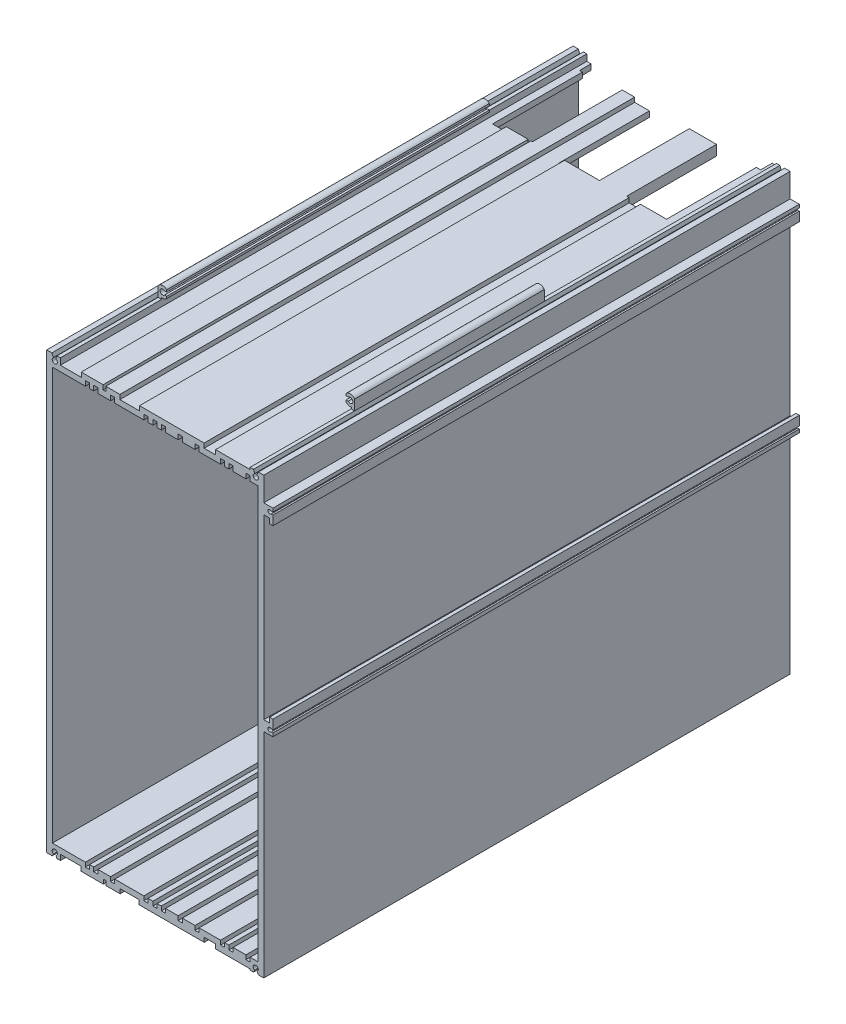
from build123d import *

# Parameters (mm, degrees)
BOSS_EXTRUDE1_DEPTH = 308
BOSS_EXTRUDE2_DEPTH = 188.8
CUT_EXTRUDE3_REACH  = 428.294
SKETCH4_W           = 77.8
SKETCH4_H           = 20.823727225
CUT_EXTRUDE4_REACH  = 424.481
SKETCH5_W           = 106
SKETCH5_H           = 6.75
CUT_EXTRUDE5_REACH  = 424.481
SKETCH6_W           = 23.35
SKETCH6_H           = 52.55


with BuildPart() as part:
    # Sketch2 → Boss-Extrude1 (new body)
    with BuildSketch(Plane.XY):
        with BuildLine():
            Line((14.499999531, 257.585773296), (14.499999531, 261.373383253))
            Line((14.499999531, 261.373383253), (12.499999531, 261.373383253))
            Line((12.499999531, 261.373383253), (11.766447114, 259.574707108))
            ThreePointArc((11.766447114, 259.574707108), (12.4449235, 259.022531512), (12.699999531, 258.185773296))
            ThreePointArc((12.699999531, 258.185773296), (10.428246686, 256.899539434), (10.494136136, 259.509312818))
            Line((10.494136136, 259.509312818), (9.499999531, 261.373383253))
            Line((9.499999531, 261.373383253), (6.499999531, 261.373383253))
            Line((6.499999531, 261.373383253), (6.499999531, 6.573383253))
            Line((6.499999531, 6.573383253), (9.699999531, 6.573383253))
            Line((9.699999531, 6.573383253), (10.453087922, 7.884956995))
            ThreePointArc((10.453087922, 7.884956995), (10.448456922, 10.483919553), (12.699999531, 9.185773296))
            ThreePointArc((12.699999531, 9.185773296), (12.47478685, 8.395256191), (11.866776475, 7.842118389))
            Line((11.866776475, 7.842118389), (12.496375142, 6.573383253))
            Line((12.496375142, 6.573383253), (14.496375142, 6.573383253))
            Line((14.496375142, 6.573383253), (14.496375142, 9.785773296))
            Line((14.496375142, 9.785773296), (26.596375142, 9.785773296))
            Line((26.596375142, 9.785773296), (26.596375142, 7.202035453))
            Line((26.596375142, 7.202035453), (39.696375142, 7.202035453))
            Line((39.696375142, 7.202035453), (39.696375142, 9.785773296))
            Line((39.696375142, 9.785773296), (41.199999531, 9.785773296))
            Line((41.199999531, 9.785773296), (41.199999531, 7.202035453))
            Line((41.199999531, 7.202035453), (49.449999531, 7.202035453))
            Line((49.449999531, 7.202035453), (49.449999531, 9.785773296))
            Line((49.449999531, 9.785773296), (60.549999531, 9.785773296))
            Line((60.549999531, 9.785773296), (60.549999531, 7.202035453))
            Line((60.549999531, 7.202035453), (98.649999531, 7.202035453))
            Line((98.649999531, 7.202035453), (98.649999531, 9.785773296))
            Line((98.649999531, 9.785773296), (105.249999531, 9.785773296))
            Line((105.249999531, 9.785773296), (105.249999531, 7.202035453))
            Line((105.249999531, 7.202035453), (125.499999531, 7.202035453))
            Line((125.499999531, 7.202035453), (125.499999531, 6.573383253))
            Line((125.499999531, 6.573383253), (127.499999531, 6.573383253))
            Line((127.499999531, 6.573383253), (128.131728013, 7.842861095))
            ThreePointArc((128.131728013, 7.842861095), (128.010191731, 10.461000193), (130.299999531, 9.185773296))
            ThreePointArc((130.299999531, 9.185773296), (130.098145789, 8.434230687), (129.54691114, 7.884956995))
            Line((129.54691114, 7.884956995), (130.299999531, 6.573383253))
            Line((130.299999531, 6.573383253), (133.499999531, 6.573383253))
            Line((133.499999531, 6.573383253), (133.499999531, 131.473383253))
            Line((133.499999531, 131.473383253), (138.849999531, 131.473383253))
            Line((138.849999531, 131.473383253), (138.849999531, 133.473383253))
            Line((138.849999531, 133.473383253), (137.935232058, 133.473383253))
            ThreePointArc((137.935232058, 133.473383253), (135.950499999, 134.164830282), (137.890474853, 134.973383253))
            Line((137.890474853, 134.973383253), (138.849999531, 134.973383253))
            Line((138.849999531, 134.973383253), (138.849999531, 140.423383253))
            Line((138.849999531, 140.423383253), (136.899999531, 140.423383253))
            Line((136.899999531, 140.423383253), (136.899999531, 137.473383253))
            Line((136.899999531, 137.473383253), (133.499999531, 137.473383253))
            Line((133.499999531, 137.473383253), (133.499999531, 241.373383253))
            Line((133.499999531, 241.373383253), (136.899999531, 241.373383253))
            Line((136.899999531, 241.373383253), (136.899999531, 238.423383253))
            Line((136.899999531, 238.423383253), (138.849999531, 238.423383253))
            Line((138.849999531, 238.423383253), (138.849999531, 243.873383253))
            Line((138.849999531, 243.873383253), (137.890474853, 243.873383253))
            ThreePointArc((137.890474853, 243.873383253), (135.950499999, 244.681936224), (137.935232058, 245.373383253))
            Line((137.935232058, 245.373383253), (138.849999531, 245.373383253))
            Line((138.849999531, 245.373383253), (138.849999531, 247.373383253))
            Line((138.849999531, 247.373383253), (133.499999531, 247.373383253))
            Line((133.499999531, 247.373383253), (133.499999531, 261.373383253))
            Line((133.499999531, 261.373383253), (130.299999531, 261.373383253))
            Line((130.299999531, 261.373383253), (129.438677048, 259.543009837))
            ThreePointArc((129.438677048, 259.543009837), (130.06649396, 258.989509485), (130.299999531, 258.185773296))
            ThreePointArc((130.299999531, 258.185773296), (127.963241315, 256.940849327), (128.233551948, 259.574707108))
            Line((128.233551948, 259.574707108), (127.499999531, 261.373383253))
            Line((127.499999531, 261.373383253), (125.499999531, 261.373383253))
            Line((125.499999531, 261.373383253), (125.499999531, 260.239968056))
            Line((125.499999531, 260.239968056), (105.299999531, 260.239968056))
            Line((105.299999531, 260.239968056), (105.299999531, 257.585773296))
            Line((105.299999531, 257.585773296), (98.599999531, 257.585773296))
            Line((98.599999531, 257.585773296), (98.599999531, 260.239968056))
            Line((98.599999531, 260.239968056), (60.799999531, 260.239968056))
            Line((60.799999531, 260.239968056), (60.799999531, 257.585773296))
            Line((60.799999531, 257.585773296), (49.299999531, 257.585773296))
            Line((49.299999531, 257.585773296), (49.299999531, 260.239968056))
            Line((49.299999531, 260.239968056), (41.099999531, 260.239968056))
            Line((41.099999531, 260.239968056), (41.099999531, 257.585773296))
            Line((41.099999531, 257.585773296), (39.499999531, 257.585773296))
            Line((39.499999531, 257.585773296), (39.499999531, 260.239968056))
            Line((39.499999531, 260.239968056), (26.699999531, 260.239968056))
            Line((26.699999531, 260.239968056), (26.699999531, 257.585773296))
            Line((26.699999531, 257.585773296), (14.499999531, 257.585773296))
        make_face()
        Polygon((9.799999531, 13.085773296), (9.799999531, 254.285773296), (29.099999531, 254.285773296), (29.099999531, 257.185773296), (31.549999531, 257.185773296), (31.549999531, 254.285773296), (33.999999531, 254.285773296), (33.999999531, 257.185773296), (36.449999531, 257.185773296), (36.449999531, 254.285773296), (43.849999531, 254.285773296), (43.849999531, 257.185773296), (46.299999531, 257.185773296), (46.299999531, 254.285773296), (63.299999531, 254.285773296), (63.299999531, 257.185773296), (65.749999531, 257.185773296), (65.749999531, 254.285773296), (68.649999531, 254.285773296), (68.649999531, 257.185773296), (71.099999531, 257.185773296), (71.099999531, 254.285773296), (73.549999531, 254.285773296), (73.549999531, 257.185773296), (75.999999531, 257.185773296), (75.999999531, 254.285773296), (83.399999531, 254.285773296), (83.399999531, 257.185773296), (85.849999531, 257.185773296), (85.849999531, 254.285773296), (93.249999531, 254.285773296), (93.249999531, 257.185773296), (95.699999531, 257.185773296), (95.699999531, 254.285773296), (108.199999531, 254.285773296), (108.199999531, 257.185773296), (110.649999531, 257.185773296), (110.649999531, 254.285773296), (113.099999531, 254.285773296), (113.099999531, 257.185773296), (115.549999531, 257.185773296), (115.549999531, 254.285773296), (123.049999531, 254.285773296), (123.049999531, 257.185773296), (125.499999531, 257.185773296), (125.499999531, 254.285773296), (130.199999531, 254.285773296), (130.199999531, 13.085773296), (125.499999531, 13.085773296), (125.499999531, 10.605647121), (123.049999531, 10.605647121), (123.049999531, 13.085773296), (115.549999531, 13.085773296), (115.549999531, 10.605647121), (113.099999531, 10.605647121), (113.099999531, 13.085773296), (110.649999531, 13.085773296), (110.649999531, 10.605647121), (108.199999531, 10.605647121), (108.199999531, 13.085773296), (95.699999531, 13.085773296), (95.699999531, 10.605647121), (93.249999531, 10.605647121), (93.249999531, 13.085773296), (85.849999531, 13.085773296), (85.849999531, 10.605647121), (83.399999531, 10.605647121), (83.399999531, 13.085773296), (75.999999531, 13.085773296), (75.999999531, 10.605647121), (73.549999531, 10.605647121), (73.549999531, 13.085773296), (71.099999531, 13.085773296), (71.099999531, 10.605647121), (68.649999531, 10.605647121), (68.649999531, 13.085773296), (65.749999531, 13.085773296), (65.749999531, 10.605647121), (63.299999531, 10.605647121), (63.299999531, 13.085773296), (46.299999531, 13.085773296), (46.299999531, 10.605647121), (43.849999531, 10.605647121), (43.849999531, 13.085773296), (36.449999531, 13.085773296), (36.449999531, 10.605647121), (33.999999531, 10.605647121), (33.999999531, 13.085773296), (31.549999531, 13.085773296), (31.549999531, 10.605647121), (29.099999531, 10.605647121), (29.099999531, 13.085773296), align=None, mode=Mode.SUBTRACT)
    extrude(amount=BOSS_EXTRUDE1_DEPTH)

    # Sketch3 → Boss-Extrude2 (add)
    with BuildSketch(Plane(origin=(0, 0, 60), x_dir=(-1, 0, 0), z_dir=(0, 0, -1))):
        with BuildLine():
            ThreePointArc((-17.499999531, 263.24640733), (-16.121371693, 262.388956123), (-14.499999531, 262.30535229))
            Line((-14.499999531, 262.30535229), (-14.499999531, 264.027871507))
            ThreePointArc((-14.499999531, 264.027871507), (-15.443429897, 263.94278526), (-16.249723759, 264.439968056))
            Line((-16.249723759, 264.439968056), (-17.499999531, 264.439968056))
            Line((-17.499999531, 264.439968056), (-17.499999531, 263.24640733))
        make_face()
        with BuildLine():
            Line((-14.499999531, 264.027871507), (-14.499999531, 262.30535229))
            ThreePointArc((-14.499999531, 262.30535229), (-13.376269152, 262.765773779), (-12.499999531, 263.606552859))
            Line((-12.499999531, 263.606552859), (-12.499999531, 267.373383253))
            ThreePointArc((-12.499999531, 267.373383253), (-13.376269152, 268.214162333), (-14.499999531, 268.674583822))
            Line((-14.499999531, 268.674583822), (-14.499999531, 266.777802835))
            ThreePointArc((-14.499999531, 266.777802835), (-13.844699353, 266.224622869), (-13.59955722, 265.402837171))
            ThreePointArc((-13.59955722, 265.402837171), (-13.844699353, 264.581051473), (-14.499999531, 264.027871507))
        make_face()
        with BuildLine():
            Line((-14.499999531, 262.30535229), (-14.499999531, 261.373383253))
            Line((-14.499999531, 261.373383253), (-12.499999531, 261.373383253))
            Line((-12.499999531, 261.373383253), (-12.499999531, 263.606552859))
            ThreePointArc((-12.499999531, 263.606552859), (-13.376269152, 262.765773779), (-14.499999531, 262.30535229))
        make_face()
        with BuildLine():
            ThreePointArc((-16.077786922, 266.539968056), (-15.323140468, 266.886080418), (-14.499999531, 266.777802835))
            Line((-14.499999531, 266.777802835), (-14.499999531, 268.674583822))
            ThreePointArc((-14.499999531, 268.674583822), (-16.121371693, 268.590979989), (-17.499999531, 267.733528783))
            Line((-17.499999531, 267.733528783), (-17.499999531, 266.539968056))
            Line((-17.499999531, 266.539968056), (-16.077786922, 266.539968056))
        make_face()
        with BuildLine():
            Line((-127.499999531, 263.606552859), (-127.499999531, 261.373383253))
            Line((-127.499999531, 261.373383253), (-125.499999531, 261.373383253))
            Line((-125.499999531, 261.373383253), (-125.499999531, 262.30535229))
            ThreePointArc((-125.499999531, 262.30535229), (-126.62372991, 262.765773779), (-127.499999531, 263.606552859))
        make_face()
        with BuildLine():
            Line((-127.499999531, 267.373383253), (-127.499999531, 263.606552859))
            ThreePointArc((-127.499999531, 263.606552859), (-126.62372991, 262.765773779), (-125.499999531, 262.30535229))
            Line((-125.499999531, 262.30535229), (-125.499999531, 264.027871507))
            ThreePointArc((-125.499999531, 264.027871507), (-126.400441842, 265.402837171), (-125.499999531, 266.777802835))
            Line((-125.499999531, 266.777802835), (-125.499999531, 268.674583822))
            ThreePointArc((-125.499999531, 268.674583822), (-126.62372991, 268.214162333), (-127.499999531, 267.373383253))
        make_face()
        with BuildLine():
            ThreePointArc((-122.499999531, 267.733528783), (-123.878627369, 268.590979989), (-125.499999531, 268.674583822))
            Line((-125.499999531, 268.674583822), (-125.499999531, 266.777802835))
            ThreePointArc((-125.499999531, 266.777802835), (-124.676858594, 266.886080418), (-123.922212141, 266.539968056))
            Line((-123.922212141, 266.539968056), (-122.499999531, 266.539968056))
            Line((-122.499999531, 266.539968056), (-122.499999531, 267.733528783))
        make_face()
        with BuildLine():
            Line((-125.499999531, 264.027871507), (-125.499999531, 262.30535229))
            ThreePointArc((-125.499999531, 262.30535229), (-123.878627369, 262.388956123), (-122.499999531, 263.24640733))
            Line((-122.499999531, 263.24640733), (-122.499999531, 264.439968056))
            Line((-122.499999531, 264.439968056), (-123.750275303, 264.439968056))
            ThreePointArc((-123.750275303, 264.439968056), (-124.556569165, 263.94278526), (-125.499999531, 264.027871507))
        make_face()
    extrude(amount=-BOSS_EXTRUDE2_DEPTH)

    # Sketch4 → Cut-Extrude3 (cut, up to next)
    with BuildSketch(Plane(origin=(127.499999531, 0, 0), x_dir=(0, 0, -1), z_dir=(1, 0, 0)), mode=Mode.PRIVATE) as cut_extrude3_sk1:
        with Locations((-98.9, 271.785246866)):
            Rectangle(SKETCH4_W, SKETCH4_H)
    cut_extrude3_tool1 = extrude(cut_extrude3_sk1.sketch, amount=-CUT_EXTRUDE3_REACH, mode=Mode.PRIVATE) & part.part
    add(cut_extrude3_tool1.solids().sort_by_distance((127.5, 271.785247, 98.9))[0], mode=Mode.SUBTRACT)

    # Sketch5 → Cut-Extrude4 (cut, up to next)
    with BuildSketch(Plane(origin=(0, 260.239968056, 0), x_dir=(1, 0, 0), z_dir=(0, 1, 0)), mode=Mode.PRIVATE) as cut_extrude4_sk1:
        with Locations((69.999999531, -3.375)):
            Rectangle(SKETCH5_W, SKETCH5_H)
    cut_extrude4_tool1 = extrude(cut_extrude4_sk1.sketch, amount=-CUT_EXTRUDE4_REACH, mode=Mode.PRIVATE) & part.part
    add(cut_extrude4_tool1.solids().sort_by_distance((70, 260.239968, 3.375))[0], mode=Mode.SUBTRACT)

    # Sketch6 → Cut-Extrude5 (cut, up to next)
    with BuildSketch(Plane(origin=(0, 260.239968056, 0), x_dir=(1, 0, 0), z_dir=(0, 1, 0)), mode=Mode.PRIVATE) as cut_extrude5_sk1:
        with Locations((108.824999531, -33.025)):
            Rectangle(SKETCH6_W, SKETCH6_H)
    cut_extrude5_tool1 = extrude(cut_extrude5_sk1.sketch, amount=-CUT_EXTRUDE5_REACH, mode=Mode.PRIVATE) & part.part
    # Sketch6 → Cut-Extrude5 (cut, up to next)
    with BuildSketch(Plane(origin=(0, 260.239968056, 0), x_dir=(1, 0, 0), z_dir=(0, 1, 0)), mode=Mode.PRIVATE) as cut_extrude5_sk2:
        with Locations((69.574999531, -33.025)):
            Rectangle(SKETCH6_W, SKETCH6_H)
    cut_extrude5_tool2 = extrude(cut_extrude5_sk2.sketch, amount=-CUT_EXTRUDE5_REACH, mode=Mode.PRIVATE) & part.part
    # Sketch6 → Cut-Extrude5 (cut, up to next)
    with BuildSketch(Plane(origin=(0, 260.239968056, 0), x_dir=(1, 0, 0), z_dir=(0, 1, 0)), mode=Mode.PRIVATE) as cut_extrude5_sk3:
        with Locations((30.324999531, -33.025)):
            Rectangle(SKETCH6_W, SKETCH6_H)
    cut_extrude5_tool3 = extrude(cut_extrude5_sk3.sketch, amount=-CUT_EXTRUDE5_REACH, mode=Mode.PRIVATE) & part.part
    add(cut_extrude5_tool1.solids().sort_by_distance((108.825, 260.239968, 33.025))[0], mode=Mode.SUBTRACT)
    add(cut_extrude5_tool2.solids().sort_by_distance((69.575, 260.239968, 33.025))[0], mode=Mode.SUBTRACT)
    add(cut_extrude5_tool3.solids().sort_by_distance((30.325, 260.239968, 33.025))[0], mode=Mode.SUBTRACT)


solid = part.part
